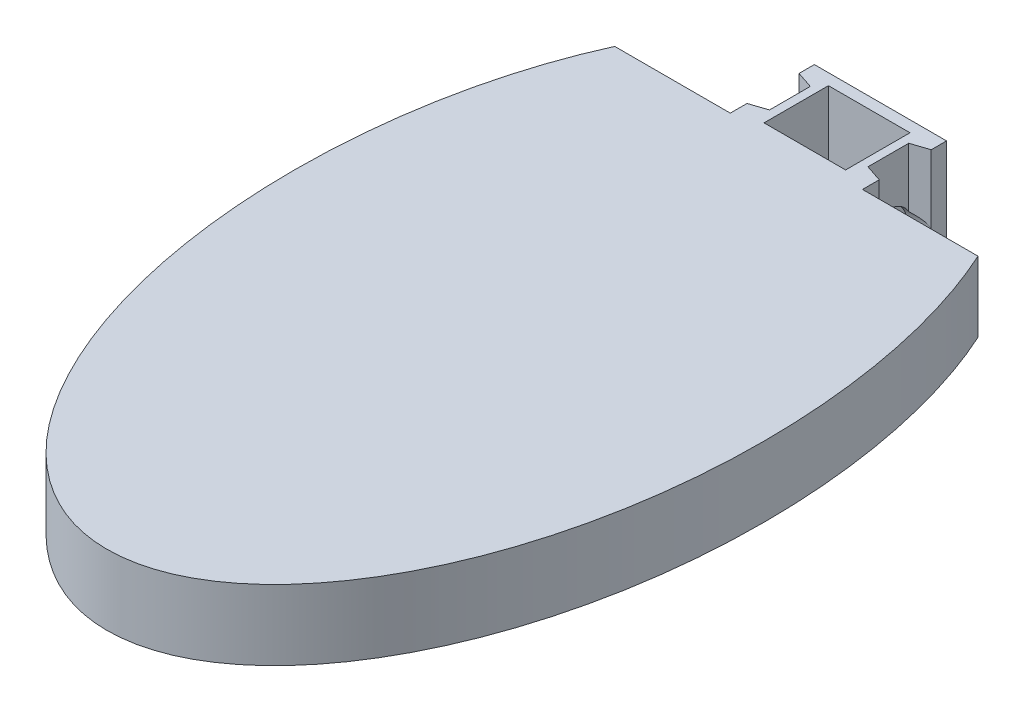
from build123d import *

# Parameters (mm, degrees)
SKETCH1_RX          = 38.1
SKETCH1_RY          = 21.209
BOSS_EXTRUDE1_DEPTH = 6.35
CUT_EXTRUDE6_DEPTH  = 45.065339906
CUT_EXTRUDE8_DEPTH  = 3.81
BOSS_EXTRUDE2_DEPTH = 11.938
CUT_EXTRUDE11_DEPTH = 45.310625914
CUT_EXTRUDE10_DEPTH = 6.35
CUT_EXTRUDE14_START = -6.35
SKETCH16_W          = 7.366
SKETCH16_H          = 5.8166
CUT_EXTRUDE14_DEPTH = 6.35


with BuildPart() as part:
    # Sketch1 → Boss-Extrude1 (new body)
    with BuildSketch(Plane(origin=(0, 0, 0), x_dir=(1, 0, 0), z_dir=(0, 1, 0))):
        with Locations(Location((0, 0), (0, 0, 90))):
            Ellipse(SKETCH1_RX, SKETCH1_RY)
    extrude(amount=BOSS_EXTRUDE1_DEPTH)

    # Sketch7 → Cut-Extrude6 (cut, through all)
    with BuildSketch(Plane(origin=(0, 6.35, 0), x_dir=(1, 0, 0), z_dir=(0, 1, 0))):
        with BuildLine():
            Line((-11.723715863, 31.75), (11.723715863, 31.75))
            add(Edge.make_bspline(
                [(11.723715863, 31.75), (0, 45.72), (-11.723715863, 31.75)],
                knots=[5.697499764, 5.697499764, 5.697499764, 6.868870851, 6.868870851, 6.868870851], degree=2, weights=[1, 0.833333333, 1]))
        make_face()
    extrude(amount=-CUT_EXTRUDE6_DEPTH, mode=Mode.SUBTRACT)

    # Sketch8 → Cut-Extrude8 (cut)
    with BuildSketch(Plane.XZ):
        Polygon((5.969, -31.75), (5.969, -24.1554), (25.250257638, -24.1554), (25.250257638, -46.762779547), (-25.868253854, -46.762779547), (-25.868253854, -24.1554), (-5.969, -24.1554), (-5.969, -31.75), align=None)
    extrude(amount=-CUT_EXTRUDE8_DEPTH, mode=Mode.SUBTRACT)

    # Sketch9 → Boss-Extrude2 (add)
    with BuildSketch(Plane(origin=(5.969, 0, 0), x_dir=(0, 0, -1), z_dir=(1, 0, 0))):
        Polygon((24.1554, 3.81), (24.1554, -2.032), (24.257, -2.032), (27.305, -4.064), (31.75, -4.064), (31.75, 3.81), align=None)
    extrude(amount=-BOSS_EXTRUDE2_DEPTH)

    # Sketch10 → Cut-Revolve1 (revolve, cut)
    with BuildSketch(Plane(origin=(5.969, 0, 0), x_dir=(0, 0, -1), z_dir=(1, 0, 0))):
        with BuildLine():
            Line((28.0162, -0.635), (28.0162, 0.635))
            ThreePointArc((28.0162, 0.635), (28.6512, 0), (28.0162, -0.635))
        make_face()
    cut_revolve1 = revolve(axis=Axis((5.969, -0.635, -28.0162), (0, 1, 0)), mode=Mode.SUBTRACT)

    # Sketch14 → Cut-Revolve2 (revolve, cut)
    with BuildSketch(Plane(origin=(0, 0, 0), x_dir=(-1, 0, 0), z_dir=(0, -1, 0))):
        Polygon((-5.969, 25.6667), (-4.064, 25.9842), (-4.064, 28.0162), (-5.969, 28.0162), align=None)
    cut_revolve2 = revolve(axis=Axis((-0.604514271, 0, -28.0162), (1, 0, 0)), mode=Mode.SUBTRACT)

    # Sketch13 → Cut-Extrude11 (cut, through all)
    with BuildSketch(Plane.XZ.offset(-3.81)):
        with BuildLine():
            Line((16.401620572, -24.1554), (5.969, -24.1554))
            Line((5.969, -24.1554), (5.969, -31.75))
            Line((5.969, -31.75), (11.723715863, -31.75))
            add(Edge.make_bspline(
                [(11.723715863, -31.75), (14.380408678, -28.584280269), (16.401620572, -24.1554)],
                knots=[0.585685543, 0.585685543, 0.585685543, 0.884081597, 0.884081597, 0.884081597], degree=2, weights=[1, 0.988890605, 1]))
        make_face()
        with BuildLine():
            Line((-11.723715863, -31.75), (-5.969, -31.75))
            Line((-5.969, -31.75), (-5.969, -24.1554))
            Line((-5.969, -24.1554), (-16.401620572, -24.1554))
            add(Edge.make_bspline(
                [(-16.401620572, -24.1554), (-14.380408678, -28.584280269), (-11.723715863, -31.75)],
                knots=[5.39910371, 5.39910371, 5.39910371, 5.697499764, 5.697499764, 5.697499764], degree=2, weights=[1, 0.988890605, 1]))
        make_face()
    extrude(amount=-CUT_EXTRUDE11_DEPTH, mode=Mode.SUBTRACT)

    # Sketch12 → Cut-Extrude10 (cut)
    with BuildSketch(Plane(origin=(0, 6.35, -25.4), x_dir=(-1, 0, 0), z_dir=(0, -1, 0))):
        Polygon((-5.969, 0.2667), (-4.445, 0.7747), (-4.445, 4.4577), (-5.969, 4.9657), align=None)
    cut_extrude10 = extrude(amount=CUT_EXTRUDE10_DEPTH, mode=Mode.SUBTRACT)

    # Mirror1: Cut-Revolve1, Cut-Revolve2, Cut-Extrude10 across plane
    add(cut_revolve1.mirror(Plane(origin=(0, 0, 0), x_dir=(0, 0, 1), z_dir=(1, 0, 0))), mode=Mode.SUBTRACT)
    add(cut_revolve2.mirror(Plane(origin=(0, 0, 0), x_dir=(0, 0, 1), z_dir=(1, 0, 0))), mode=Mode.SUBTRACT)
    add(cut_extrude10.mirror(Plane(origin=(0, 0, 0), x_dir=(0, 0, 1), z_dir=(1, 0, 0))), mode=Mode.SUBTRACT)

    # Sketch16 → Cut-Extrude14 (cut)
    with BuildSketch(Plane(origin=(0, 6.35, 0), x_dir=(1, 0, 0), z_dir=(0, 1, 0)).offset(CUT_EXTRUDE14_START)):
        with Locations((0, 27.8257)):
            Rectangle(SKETCH16_W, SKETCH16_H)
    extrude(amount=CUT_EXTRUDE14_DEPTH, mode=Mode.SUBTRACT)


solid = part.part
